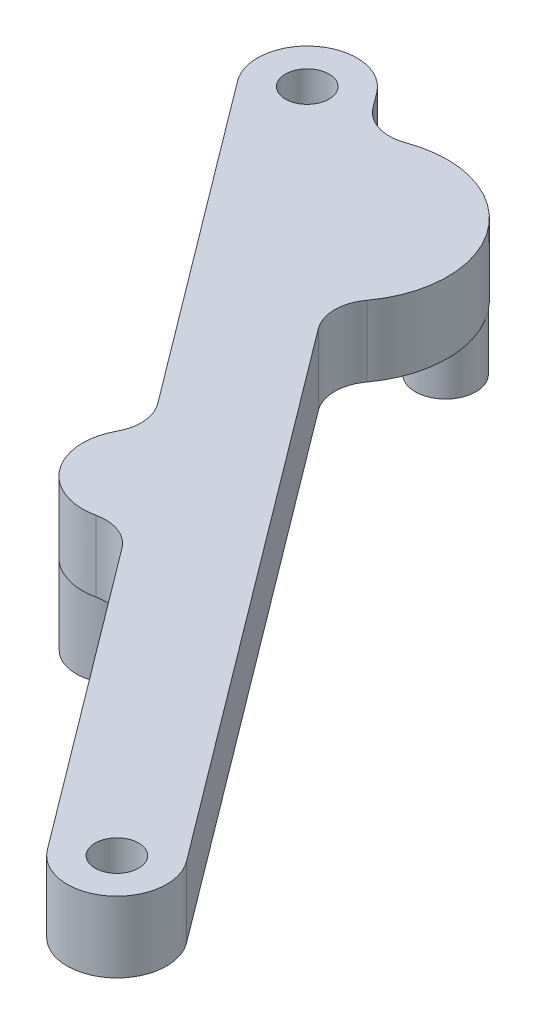
from build123d import *

# Parameters (mm, degrees)
SKETCH1_R           = 1.6
BOSS_EXTRUDE1_DEPTH = 5.2
SKETCH2_R           = 3
BOSS_EXTRUDE2_DEPTH = 6
SKETCH3_R           = 2.2225
BOSS_EXTRUDE3_DEPTH = 4.21


with BuildPart() as part:
    # Sketch1 → Boss-Extrude1 (new body)
    with BuildSketch(Plane(origin=(0, 0, 0), x_dir=(1, 0, 0), z_dir=(0, 1, 0))):
        with BuildLine():
            Line((13.571690234, 65.253997386), (31.177749859, 41.779251219))
            ThreePointArc((31.177749859, 41.779251219), (31.769771696, 40.197895519), (31.413929092, 38.547273896))
            ThreePointArc((31.413929092, 38.547273896), (31.744690234, 34.020997386), (35.997302563, 32.436109267))
            ThreePointArc((35.997302563, 32.436109267), (37.681535251, 32.315544113), (39.033870608, 31.304423554))
            Line((39.033870608, 31.304423554), (55.481690234, 9.373997386))
            ThreePointArc((55.481690234, 9.373997386), (60.591690234, 8.643997386), (61.321690234, 13.753997386))
            Line((61.321690234, 13.753997386), (32.283591318, 52.471462608))
            ThreePointArc((32.283591318, 52.471462608), (31.683609832, 54.260923069), (32.271003193, 56.054555017))
            ThreePointArc((32.271003193, 56.054555017), (32.239690234, 64.967497386), (23.692033188, 67.493181691))
            ThreePointArc((23.692033188, 67.493181691), (21.805676377, 67.431501009), (20.25578915, 68.508532165))
            Line((20.25578915, 68.508532165), (19.411690234, 69.633997386))
            ThreePointArc((19.411690234, 69.633997386), (14.301690234, 70.363997386), (13.571690234, 65.253997386))
        make_face()
        with Locations(Location((16.491690234, 67.443997386, 0), (0, 0, 270))):
            Circle(SKETCH1_R, mode=Mode.SUBTRACT)
        with Locations(Location((58.401690234, 11.563997386, 0), (0, 0, 270))):
            Circle(SKETCH1_R, mode=Mode.SUBTRACT)
    extrude(amount=BOSS_EXTRUDE1_DEPTH)

    # Sketch2 → Boss-Extrude2 (add)
    with BuildSketch(Plane.XZ):
        with Locations(Location((34.144690234, -35.820997386, 0), (0, 0, 143.129227332))):
            Circle(SKETCH2_R)
    extrude(amount=BOSS_EXTRUDE2_DEPTH)

    # Sketch3 → Boss-Extrude3 (add)
    with BuildSketch(Plane.XZ):
        with Locations(Location((30.461690234, -63.633997386, 0), (0, 0, 323.129453592))):
            Circle(SKETCH3_R)
    extrude(amount=BOSS_EXTRUDE3_DEPTH)


solid = part.part
